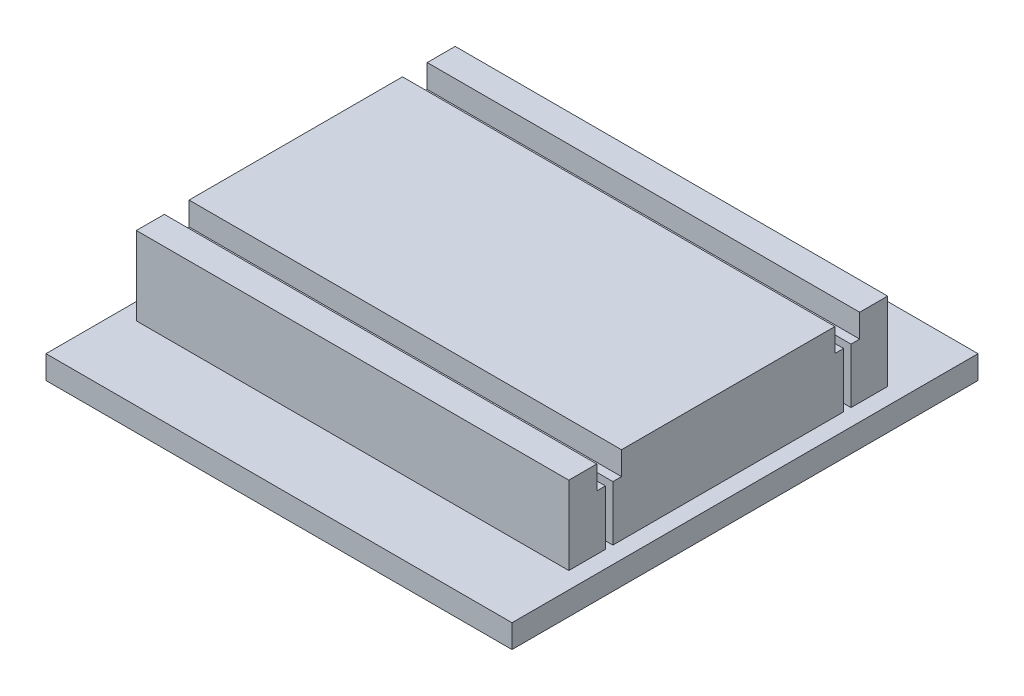
from build123d import *

# Parameters (mm, degrees)
SKETCH1_W           = 46.4
SKETCH1_H           = 24.75
BOSS_EXTRUDE1_DEPTH = 5.9
BOSS_EXTRUDE2_DEPTH = 2.5
SKETCH3_W           = 50
SKETCH3_H           = 50
BOSS_EXTRUDE3_DEPTH = 2.5
SKETCH4_W           = 46.4
SKETCH4_H           = 0.93
BOSS_EXTRUDE4_DEPTH = 5.9
SKETCH5_W           = 46.4
SKETCH5_H           = 0.93
BOSS_EXTRUDE5_DEPTH = 5.9
SKETCH6_W           = 46.4
SKETCH6_H           = 3
BOSS_EXTRUDE6_DEPTH = 8.4
SKETCH7_W           = 46.4
SKETCH7_H           = 3
BOSS_EXTRUDE7_DEPTH = 8.4


with BuildPart() as part:
    # Sketch1 → Boss-Extrude1 (new body)
    with BuildSketch(Plane(origin=(0, 0, 0), x_dir=(1, 0, 0), z_dir=(0, 1, 0))):
        Rectangle(SKETCH1_W, SKETCH1_H)
    extrude(amount=BOSS_EXTRUDE1_DEPTH)

    # Sketch2 → Boss-Extrude2 (add)
    with BuildSketch(Plane(origin=(0, 5.9, 0), x_dir=(1, 0, 0), z_dir=(0, 1, 0))):
        Polygon((23.2, -11.45), (23.2, 0), (23.2, 11.45), (-23.2, 11.45), (-23.2, -11.45), align=None)
    extrude(amount=BOSS_EXTRUDE2_DEPTH)

    # Sketch3 → Boss-Extrude3 (add)
    with BuildSketch(Plane.XZ):
        Rectangle(SKETCH3_W, SKETCH3_H)
    extrude(amount=BOSS_EXTRUDE3_DEPTH)

    # Sketch4 → Boss-Extrude4 (add)
    with BuildSketch(Plane(origin=(0, 0, 0), x_dir=(1, 0, 0), z_dir=(0, 1, 0))):
        with Locations((0, 13.64)):
            Rectangle(SKETCH4_W, SKETCH4_H)
    extrude(amount=BOSS_EXTRUDE4_DEPTH)

    # Sketch5 → Boss-Extrude5 (add)
    with BuildSketch(Plane(origin=(0, 0, 0), x_dir=(1, 0, 0), z_dir=(0, 1, 0))):
        with Locations((0, -13.64)):
            Rectangle(SKETCH5_W, SKETCH5_H)
    extrude(amount=BOSS_EXTRUDE5_DEPTH)

    # Sketch6 → Boss-Extrude6 (add)
    with BuildSketch(Plane(origin=(0, 0, 0), x_dir=(1, 0, 0), z_dir=(0, 1, 0))):
        with Locations((0, 15.605)):
            Rectangle(SKETCH6_W, SKETCH6_H)
    extrude(amount=BOSS_EXTRUDE6_DEPTH)

    # Sketch7 → Boss-Extrude7 (add)
    with BuildSketch(Plane(origin=(0, 0, 0), x_dir=(1, 0, 0), z_dir=(0, 1, 0))):
        with Locations((0, -15.605)):
            Rectangle(SKETCH7_W, SKETCH7_H)
    extrude(amount=BOSS_EXTRUDE7_DEPTH)


solid = part.part
